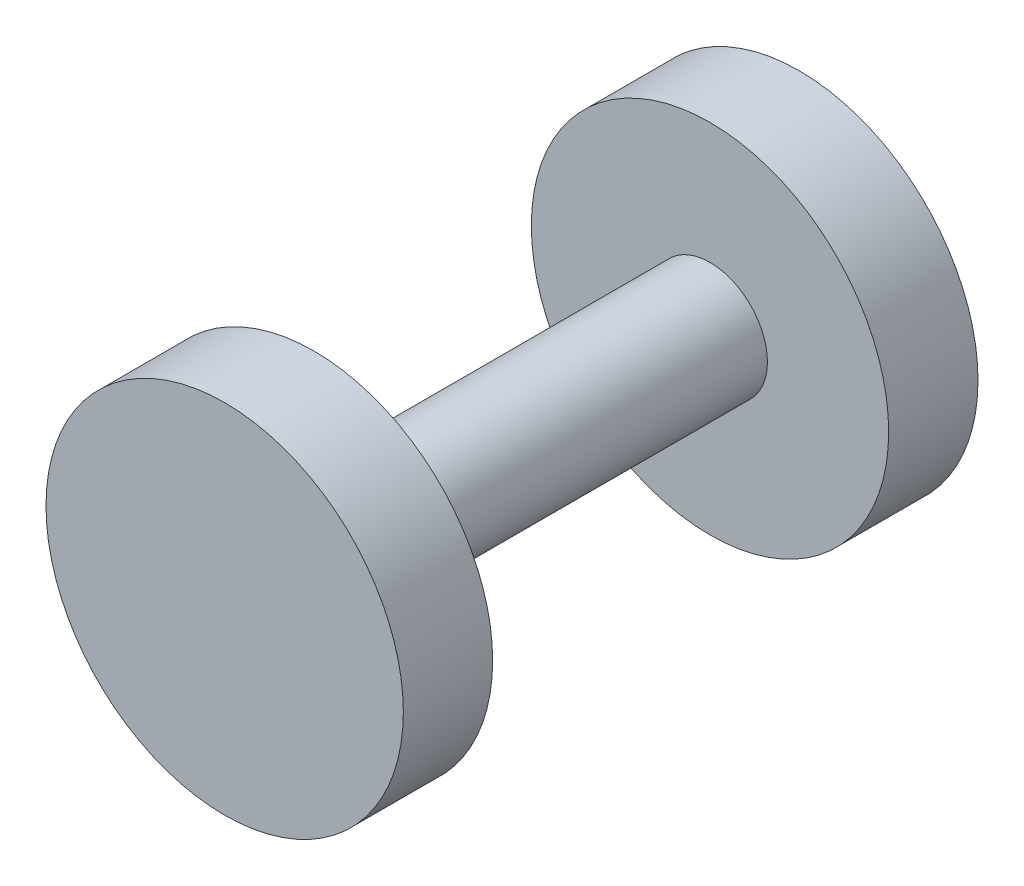
from build123d import *


with BuildPart() as part:
    # Sketch2 → Revolve1 (revolve)
    with BuildSketch(Plane(origin=(0, 0, 0), x_dir=(0, 0, -1), z_dir=(1, 0, 0))):
        Polygon((7.328519856, 0), (-24.837545126, 0), (-24.837545126, 10), (-19.837545126, 10), (-19.837545126, 3.21299639), (2.328519856, 3.21299639), (2.328519856, 10), (7.328519856, 10), align=None)
    revolve(axis=Axis((0, 0, -7.328519856), (0, 0, 1)))


solid = part.part
